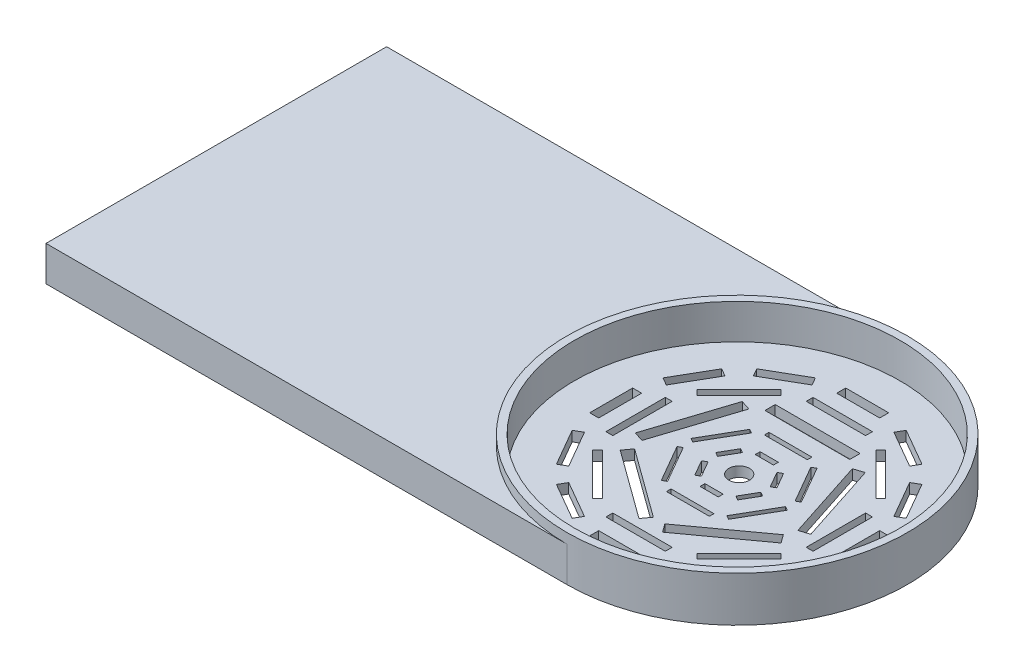
from build123d import *

# Parameters (mm, degrees)
SKETCH_2_R           = 32.5
EXTRUDE_2_DEPTH      = 2
SKETCH_3_R           = 2.065299263
SKETCH_3_W           = 3.634517066
SKETCH_3_H           = 0.972738316
SKETCH_3_H_2         = 0.972738315
SKETCH_3_W_2         = 8.575403128
SKETCH_3_H_3         = 0.913568408
SKETCH_3_H_4         = 0.913568407
SKETCH_3_W_3         = 16.93922902
SKETCH_3_H_5         = 2.056372223
SKETCH_3_H_6         = 1.799325695
SKETCH_3_W_4         = 1.799325695
SKETCH_3_H_7         = 8.575403129
SKETCH_3_W_5         = 11.860354008
SKETCH_3_H_8         = 1.369825
SKETCH_3_W_6         = 1.369825
SKETCH_3_H_9         = 11.860354008
CUT_EXTRUDE_1_DEPTH  = 2
EXTRUDE_3_DEPTH      = 7
EXTRUDE_3_DEPTH_BACK = 2
SKETCH_4_R           = 34.00500901
SKETCH_4_R_2         = 32.5
EXTRUDE_START        = 7
EXTRUDE_4_DEPTH      = 7


with BuildPart() as part:
    # 草图2 → 凸台-拉伸2 (new body)
    with BuildSketch(Plane(origin=(0, 0, 0), x_dir=(1, 0, 0), z_dir=(0, 1, 0))):
        with Locations(Location((0, 0, 0), (0, 0, 270))):
            Circle(SKETCH_2_R)
    extrude(amount=EXTRUDE_2_DEPTH)

    # 草图3 → 切除-拉伸1 (cut)
    with BuildSketch(Plane(origin=(0, 2, 0), x_dir=(1, 0, 0), z_dir=(0, 1, 0))):
        with Locations(Location((0.132079869, 0.264159738, 0), (0, 0, 270))):
            Circle(SKETCH_3_R)
        Polygon((4.419781433, 4.838054797), (3.577365341, 4.351685639), (5.394623874, 1.20410153), (6.237039966, 1.690470687), align=None)
        with Locations((0.132079869, 5.777996588)):
            Rectangle(SKETCH_3_W, SKETCH_3_H)
        Polygon((6.237039966, -1.162151211), (5.394623874, -0.675782054), (3.577365341, -3.823366163), (4.419781433, -4.309735321), align=None)
        with Locations((0.132079869, -5.249677113)):
            Rectangle(SKETCH_3_W, SKETCH_3_H_2)
        Polygon((-4.155621695, -4.309735321), (-3.313205603, -3.823366163), (-5.130464136, -0.675782054), (-5.972880228, -1.162151211), align=None)
        Polygon((-5.972880228, 1.690470687), (-5.130464136, 1.20410153), (-3.313205603, 4.351685639), (-4.155621695, 4.838054797), align=None)
        with Locations((0.132079869, 10.044028173)):
            Rectangle(SKETCH_3_W_2, SKETCH_3_H_3)
        Polygon((6.853430322, 9.095744536), (6.062256873, 8.638960332), (10.349958437, 1.212443375), (11.141131886, 1.669227579), align=None)
        Polygon((11.141131886, -1.140908103), (10.349958437, -0.684123899), (6.062256873, -8.110640856), (6.853430322, -8.56742506), align=None)
        with Locations((0.132079869, -9.515708698)):
            Rectangle(SKETCH_3_W_2, SKETCH_3_H_4)
        Polygon((-6.589270584, -8.56742506), (-5.798097135, -8.110640856), (-10.085798699, -0.684123899), (-10.876972148, -1.140908103), align=None)
        Polygon((-10.876972148, 1.669227579), (-10.085798699, 1.212443375), (-5.798097135, 8.638960332), (-6.589270584, 9.095744536), align=None)
        with Locations((0.132079869, 14.903001057)):
            Rectangle(SKETCH_3_W_3, SKETCH_3_H_5)
        Polygon((12.415053578, 13.160619536), (10.459327375, 12.525165572), (15.693837014, -3.584998569), (17.649563217, -2.949544605), align=None)
        Polygon((16.192989615, -7.432417203), (14.984284348, -5.768777127), (1.280160199, -15.725406131), (2.488865465, -17.389046206), align=None)
        Polygon((-2.224705727, -17.389046206), (-1.016000461, -15.725406131), (-14.72012461, -5.768777127), (-15.928829877, -7.432417203), align=None)
        Polygon((-17.385403479, -2.949544605), (-15.429677276, -3.584998569), (-10.195167637, 12.525165572), (-12.15089384, 13.160619536), align=None)
        with Locations((0.132079869, 24.927815646)):
            Rectangle(SKETCH_3_W_2, SKETCH_3_H_6)
        Polygon((9.200480768, 24.546493967), (8.30081792, 22.988232205), (15.727334878, 18.700530641), (16.626997725, 20.258792403), align=None)
        Polygon((20.126712534, 16.759077594), (18.568450772, 15.859414746), (22.856152336, 8.432897789), (24.414414098, 9.332560637), align=None)
        with Locations((24.795735777, 0.264159738)):
            Rectangle(SKETCH_3_W_4, SKETCH_3_H_7)
        Polygon((24.414414098, -8.804241161), (22.856152336, -7.904578313), (18.568450772, -15.331095271), (20.126712534, -16.230758118), align=None)
        Polygon((16.626997725, -19.730472927), (15.727334878, -18.172211165), (8.30081792, -22.459912729), (9.200480768, -24.018174491), align=None)
        with Locations((0.132079869, -24.39949617)):
            Rectangle(SKETCH_3_W_2, SKETCH_3_H_6)
        Polygon((-8.93632103, -24.018174491), (-8.036658182, -22.459912729), (-15.46317514, -18.172211165), (-16.362837987, -19.730472927), align=None)
        Polygon((-19.862552796, -16.230758118), (-18.304291034, -15.331095271), (-22.591992598, -7.904578313), (-24.15025436, -8.804241161), align=None)
        with Locations((-24.531576039, 0.264159738)):
            Rectangle(SKETCH_3_W_4, SKETCH_3_H_7)
        Polygon((-24.15025436, 9.332560637), (-22.591992598, 8.432897789), (-18.304291034, 15.859414746), (-19.862552796, 16.759077594), align=None)
        Polygon((-16.362837987, 20.258792403), (-15.46317514, 18.700530641), (-8.036658182, 22.988232205), (-8.93632103, 24.546493967), align=None)
        Polygon((9.592845567, 18.111462182), (10.561458114, 19.080074729), (18.94799486, 10.693537983), (17.979382313, 9.724925436), align=None)
        with Locations((0.132079869, 20.258792403)):
            Rectangle(SKETCH_3_W_5, SKETCH_3_H_8)
        with Locations((20.126712534, 0.264159738)):
            Rectangle(SKETCH_3_W_6, SKETCH_3_H_9)
        Polygon((17.979382313, -9.19660596), (18.94799486, -10.165218507), (10.561458114, -18.551755253), (9.592845567, -17.583142706), align=None)
        with Locations((0.132079869, -19.730472927)):
            Rectangle(SKETCH_3_W_5, SKETCH_3_H_8)
        Polygon((-9.328685829, -17.583142706), (-10.297298376, -18.551755253), (-18.683835122, -10.165218507), (-17.715222575, -9.19660596), align=None)
        with Locations((-19.862552796, 0.264159738)):
            Rectangle(SKETCH_3_W_6, SKETCH_3_H_9)
        Polygon((-17.715222575, 9.724925436), (-18.683835122, 10.693537983), (-10.297298376, 19.080074729), (-9.328685829, 18.111462182), align=None)
    extrude(amount=-CUT_EXTRUDE_1_DEPTH, mode=Mode.SUBTRACT)

    # 草图4 → 凸台-拉伸3 (add, two sides: drawn at the far end of the back side and taken through both)
    with BuildSketch(Plane(origin=(0, 2, 0), x_dir=(1, 0, 0), z_dir=(0, 1, 0)).offset(-EXTRUDE_3_DEPTH_BACK)):
        with Locations(Location((0, 0, 0), (0, 0, 270))):
            Circle(SKETCH_4_R)
        with Locations(Location((0, 0, 0), (0, 0, 270))):
            Circle(SKETCH_4_R_2, mode=Mode.SUBTRACT)
    extrude(amount=EXTRUDE_3_DEPTH + EXTRUDE_3_DEPTH_BACK)

    # 草图5 → 凸台-拉伸4 (add)
    with BuildSketch(Plane(origin=(0, 0, 0), x_dir=(1, 0, 0), z_dir=(0, 1, 0)).offset(EXTRUDE_START)):
        with BuildLine():
            Line((-34.00500901, 34.00500901), (-104.00500901, 34.00500901))
            Line((-104.00500901, 34.00500901), (-104.00500901, -34.00500901))
            Line((-104.00500901, -34.00500901), (0, -34.00500901))
            ThreePointArc((0, -34.00500901), (-34.00500901, 0), (0, 34.00500901))
            Line((0, 34.00500901), (-34.00500901, 34.00500901))
        make_face()
    extrude(amount=-EXTRUDE_4_DEPTH)


solid = part.part
